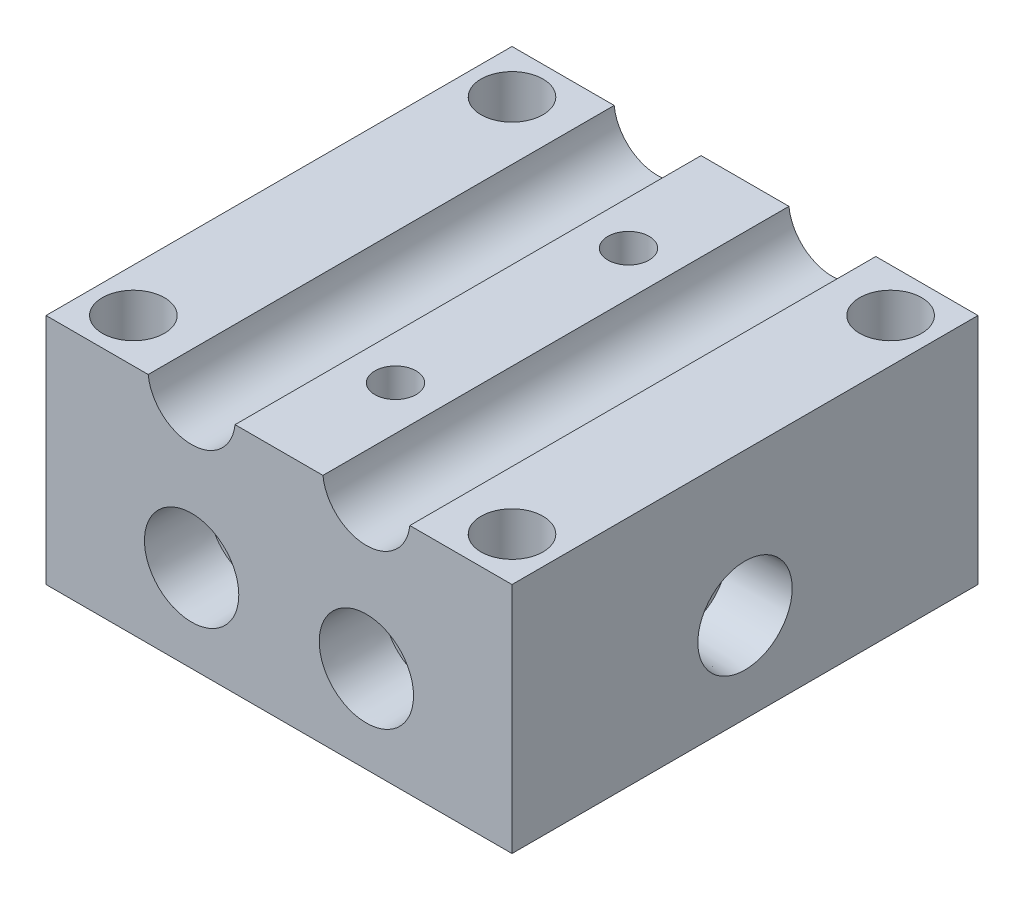
from build123d import *

# Parameters (mm, degrees)
SKETCH1_W                         = 50.8
SKETCH1_H                         = 50.8
BOSS_EXTRUDE1_DEPTH               = 25.4
SKETCH2_R                         = 4.7625
CUT_EXTRUDE1_DEPTH                = 63.217039467
F_1_4_CLEARANCE_HOLE1_D           = 6.7564
F_8_CLEARANCE_HOLE1_D             = 4.4958
SKETCH9_R                         = 4.445
CUT_EXTRUDE3_DEPTH                = 6.35
F_1_8_NPT_TAPPED_HOLE1_AT_2_COUNT = 2
F_1_8_NPT_TAPPED_HOLE1_AT_2_PITCH = 19.05


with BuildPart() as part:
    # Sketch1 → Boss-Extrude1 (new body)
    with BuildSketch(Plane(origin=(0, 0, 0), x_dir=(1, 0, 0), z_dir=(0, 1, 0))):
        Rectangle(SKETCH1_W, SKETCH1_H)
    extrude(amount=BOSS_EXTRUDE1_DEPTH)

    # Sketch2 → Cut-Extrude1 (cut, through all)
    with BuildSketch(Plane.XY.offset(25.4)):
        with Locations((-9.525, 25.908)):
            Circle(SKETCH2_R)
        with Locations((9.525, 25.908)):
            Circle(SKETCH2_R)
    extrude(amount=-CUT_EXTRUDE1_DEPTH, mode=Mode.SUBTRACT)

    # 1/4 Clearance Hole1 (through all)
    with Locations(Plane(origin=(0, 25.4, 0), x_dir=(1, 0, 0), z_dir=(0, 1, 0))):
        with Locations((-20.6375, 20.6375), (-20.6375, -20.6375), (20.6375, -20.6375), (20.6375, 20.6375)):
            Hole(F_1_4_CLEARANCE_HOLE1_D / 2)

    # #8 Clearance Hole1 (through all)
    with Locations(Plane(origin=(0, 25.4, 0), x_dir=(1, 0, 0), z_dir=(0, 1, 0))):
        with Locations((0, 12.7), (0, -12.7)):
            Hole(F_8_CLEARANCE_HOLE1_D / 2)

    # Sketch9 → Cut-Extrude3 (cut)
    with BuildSketch(Plane.XZ):
        with Locations(Location((0, 12.7, 0), (0, 0, 270))):
            Circle(SKETCH9_R)
        with Locations(Location((0, -12.7, 0), (0, 0, 270))):
            Circle(SKETCH9_R)
    extrude(amount=-CUT_EXTRUDE3_DEPTH, mode=Mode.SUBTRACT)

    # Sketch10 → 1/8 NPT Tapped Hole1 (revolve, cut)
    with BuildSketch(Plane(origin=(-9.525, 9.525, 25.4), x_dir=(0, -1, 0), z_dir=(1, 0, 0))):
        Polygon((0, 0), (0, 46.983468714), (4.2164, 44.45), (4.2164, 6.858), (4.936181096, 6.858), (5.1415188, 0), align=None)
    f_1_8_npt_tapped_hole1 = revolve(axis=Axis((-9.525, 9.525, 31.75), (0, 0, -1)), mode=Mode.SUBTRACT)

    # 1/8 NPT Tapped Hole1 at 2: 1/8 NPT Tapped Hole1 ×2
    with Locations(*[(i * F_1_8_NPT_TAPPED_HOLE1_AT_2_PITCH, 0, 0) for i in range(1, F_1_8_NPT_TAPPED_HOLE1_AT_2_COUNT)]):
        add(f_1_8_npt_tapped_hole1, mode=Mode.SUBTRACT)

    # Sketch14 → 1/8 NPT Tapped Hole3 (revolve, cut)
    with BuildSketch(Plane(origin=(25.4, 9.77926984, 0), x_dir=(0, 0, -1), z_dir=(0, 1, 0))):
        Polygon((0, 0), (0, 46.983468714), (4.2164, 44.45), (4.2164, 6.858), (4.936181096, 6.858), (5.1415188, 0), align=None)
    revolve(axis=Axis((31.75, 9.77926984, 0), (-1, 0, 0)), mode=Mode.SUBTRACT)


solid = part.part
